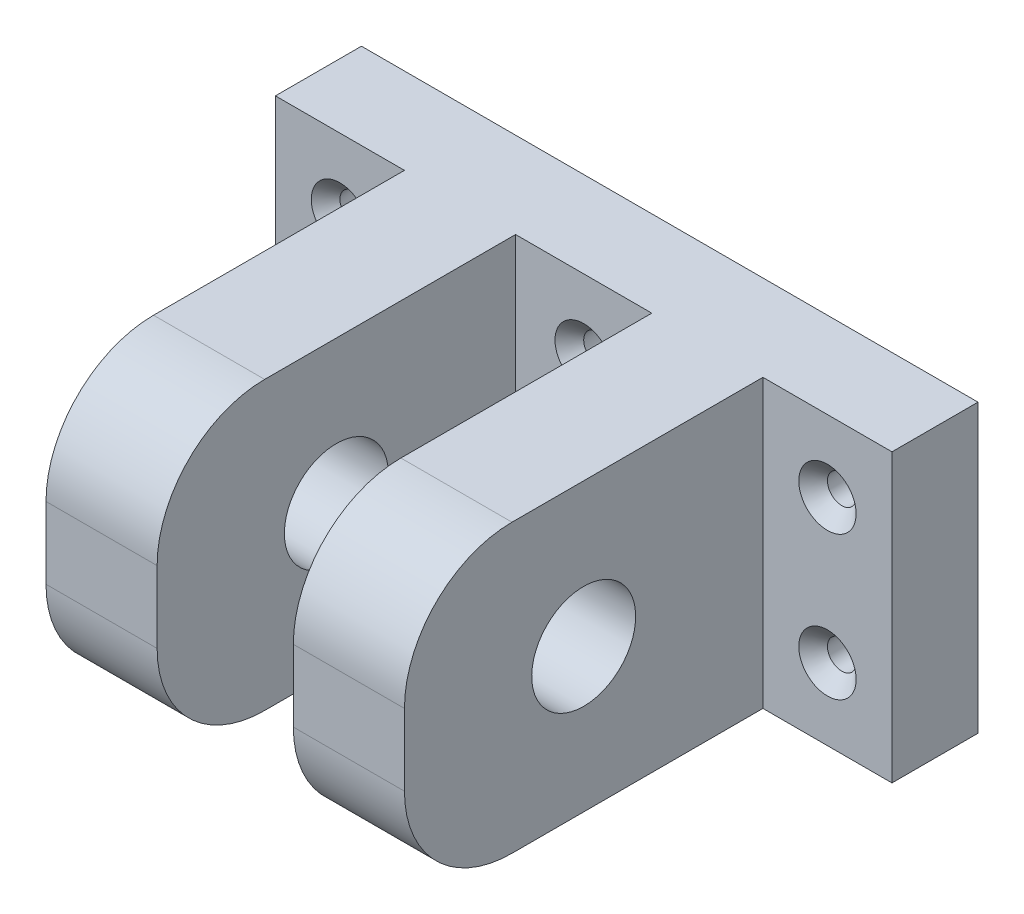
from build123d import *

# Parameters (mm, degrees)
SKETCH1_W           = 86
SKETCH1_H           = 40
BOSS_EXTRUDE1_DEPTH = 12
SKETCH2_W           = 15.5
SKETCH2_H           = 40
BOSS_EXTRUDE2_DEPTH = 50
SKETCH3_R           = 7.25
CUT_EXTRUDE1_DEPTH  = 50
FILLET1_R           = 15
SKETCH5_R           = 2
CUT_EXTRUDE2_DEPTH  = 50
CHAMFER1_SIZE       = 2
SKETCH6_R           = 3
CUT_EXTRUDE3_DEPTH  = 10
SKETCH7_R           = 5
CUT_EXTRUDE4_DEPTH  = 5


with BuildPart() as part:
    # Sketch1 → Boss-Extrude1 (new body)
    with BuildSketch(Plane.XY):
        with Locations((43, 20)):
            Rectangle(SKETCH1_W, SKETCH1_H)
    extrude(amount=BOSS_EXTRUDE1_DEPTH)

    # Sketch2 → Boss-Extrude2 (add)
    with BuildSketch(Plane.XY.offset(12)):
        with Locations((25.75, 20)):
            Rectangle(SKETCH2_W, SKETCH2_H)
        with Locations((60.25, 20)):
            Rectangle(SKETCH2_W, SKETCH2_H)
    extrude(amount=BOSS_EXTRUDE2_DEPTH)

    # Sketch3 → Cut-Extrude1 (cut)
    with BuildSketch(Plane.ZY.offset(-18)):
        with Locations(Location((37, 20, 0), (0, 0, 270))):
            Circle(SKETCH3_R)
    extrude(amount=-CUT_EXTRUDE1_DEPTH, mode=Mode.SUBTRACT)

    # Fillet1
    fillet1_edges = [part.edges().sort_by_distance(p)[0] for p in [
        (25.75, 0, 62),
        (25.75, 40, 62),
        (60.25, 0, 62),
        (60.25, 40, 62),
    ]]
    fillet(fillet1_edges, radius=FILLET1_R)

    # Sketch5 → Cut-Extrude2 (cut)
    with BuildSketch(Plane.XY.offset(12)):
        with Locations((9, 30)):
            Circle(SKETCH5_R)
        with Locations((9, 10)):
            Circle(SKETCH5_R)
        with Locations((43, 30)):
            Circle(SKETCH5_R)
        with Locations((43, 10)):
            Circle(SKETCH5_R)
        with Locations((77, 30)):
            Circle(SKETCH5_R)
        with Locations((77, 10)):
            Circle(SKETCH5_R)
    extrude(amount=-CUT_EXTRUDE2_DEPTH, mode=Mode.SUBTRACT)

    # Chamfer1
    chamfer1_edges = [part.edges().sort_by_distance(p)[0] for p in [
        (7, 30, 12),
        (75, 10, 12),
        (75, 30, 12),
        (41, 10, 12),
        (41, 30, 12),
        (7, 10, 12),
    ]]
    chamfer(chamfer1_edges, length=CHAMFER1_SIZE)

    # Sketch6 → Cut-Extrude3 (cut)
    with BuildSketch(Plane(origin=(0, 0, 0), x_dir=(-1, 0, 0), z_dir=(0, 0, -1))):
        with Locations((-10, 20)):
            Circle(SKETCH6_R)
        with Locations((-40, 20)):
            Circle(SKETCH6_R)
    extrude(amount=-CUT_EXTRUDE3_DEPTH, mode=Mode.SUBTRACT)

    # Sketch7 → Cut-Extrude4 (cut)
    with BuildSketch(Plane(origin=(0, 0, 0), x_dir=(-1, 0, 0), z_dir=(0, 0, -1))):
        with Locations((-10, 20)):
            Circle(SKETCH7_R)
        with Locations((-40, 20)):
            Circle(SKETCH7_R)
    extrude(amount=-CUT_EXTRUDE4_DEPTH, mode=Mode.SUBTRACT)


solid = part.part
